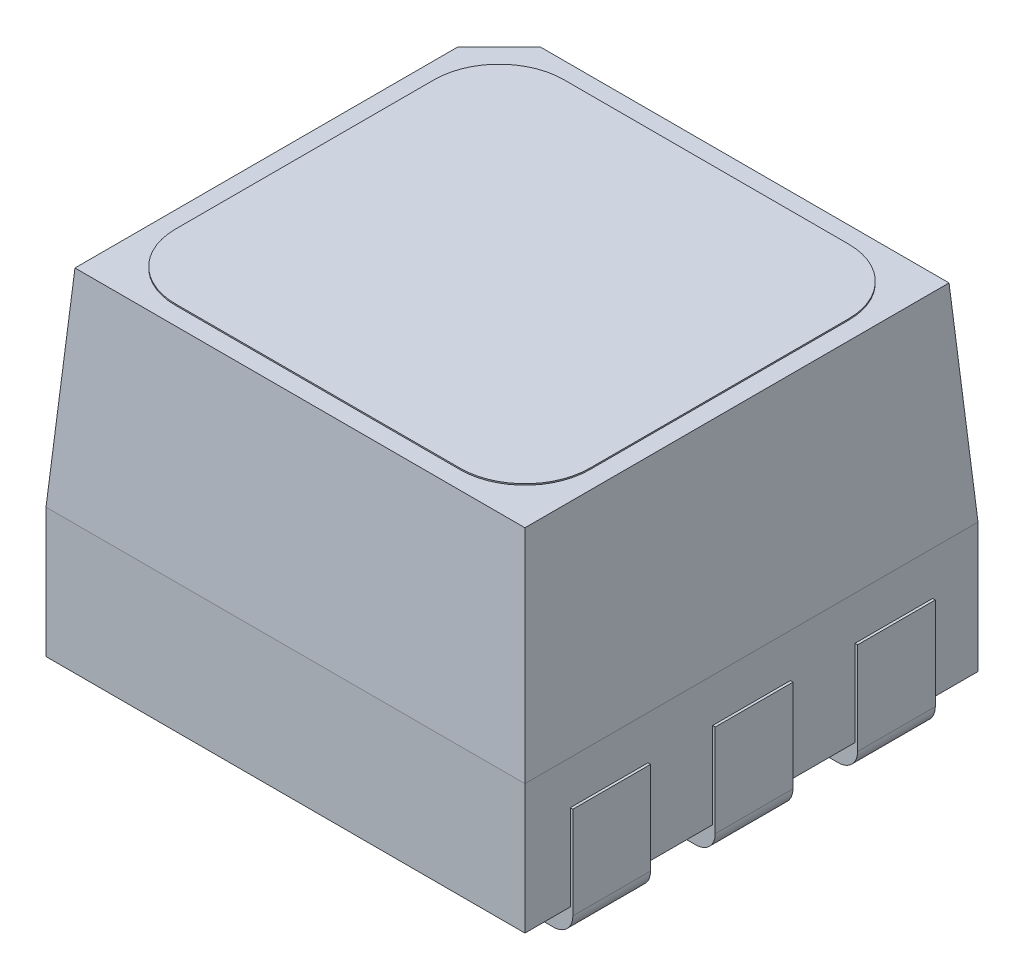
from build123d import *

# Parameters (mm, degrees)
ESQUISSE1_W                  = 3.7
ESQUISSE1_H                  = 3.5
BOSS_EXTRU_1_DEPTH           = 1
ESQUISSE2_W                  = 3.7
ESQUISSE2_H                  = 3.5
BOSS_EXTRU_2_DEPTH           = 1.6
BOSS_EXTRU_2_TAPER           = 4
BOSS_EXTRU_3_DEPTH           = 0.01
ENL_V_MAT_EXTRU_2_DEPTH      = 0.5
ESQUISSE5_W                  = 0.8
ESQUISSE5_H                  = 0.6
BOSS_EXTRU_4_DEPTH           = 0.2
ESQUISSE6_W                  = 0.6
ESQUISSE6_H                  = 0.864001059
ENL_V_MAT_EXTRU_3_DEPTH      = 0.2
ESQUISSE8_W                  = 0.6
ESQUISSE8_H                  = 0.800354125
ENL_V_MAT_EXTRU_4_DEPTH      = 0.2
ESQUISSE9_W                  = 0.6
ESQUISSE9_H                  = 0.864001059
BOSS_EXTRU_5_DEPTH           = 0.22
ESQUISSE10_W                 = 0.6
ESQUISSE10_H                 = 0.800354125
BOSS_EXTRU_6_DEPTH           = 0.22
ENL_V_MAT_EXTRU_5_DEPTH      = 5.497944045
CORPS_D_PLACER_COPIER1_ANGLE = 180


with BuildPart() as part:
    # Esquisse1 → Boss.-Extru.1 (new body)
    with BuildSketch(Plane(origin=(0, 0, 0), x_dir=(1, 0, 0), z_dir=(0, 1, 0))):
        Rectangle(ESQUISSE1_W, ESQUISSE1_H)
    extrude(amount=BOSS_EXTRU_1_DEPTH)

    # Esquisse5 → Boss.-Extru.4 (add)
    with BuildSketch(Plane.XZ):
        with Locations((-1.45, 0)):
            Rectangle(ESQUISSE5_W, ESQUISSE5_H)
        with Locations((1.45, 0)):
            Rectangle(ESQUISSE5_W, ESQUISSE5_H)
        with Locations((1.45, 1.1)):
            Rectangle(ESQUISSE5_W, ESQUISSE5_H)
        with Locations((-1.45, 1.1)):
            Rectangle(ESQUISSE5_W, ESQUISSE5_H)
        with Locations((1.45, -1.1)):
            Rectangle(ESQUISSE5_W, ESQUISSE5_H)
        with Locations((-1.45, -1.1)):
            Rectangle(ESQUISSE5_W, ESQUISSE5_H)
    extrude(amount=BOSS_EXTRU_4_DEPTH)

    # Esquisse6 → Enlèv. mat.-Extru.3 (cut)
    with BuildSketch(Plane.ZY.offset(1.85)):
        with Locations((-1.1, 0.23200053)):
            Rectangle(ESQUISSE6_W, ESQUISSE6_H)
        with Locations((0, 0.23200053)):
            Rectangle(ESQUISSE6_W, ESQUISSE6_H)
        with Locations((1.1, 0.23200053)):
            Rectangle(ESQUISSE6_W, ESQUISSE6_H)
    extrude(amount=-ENL_V_MAT_EXTRU_3_DEPTH, mode=Mode.SUBTRACT)

    # Esquisse8 → Enlèv. mat.-Extru.4 (cut)
    with BuildSketch(Plane(origin=(1.85, 0, 0), x_dir=(0, 0, -1), z_dir=(1, 0, 0))):
        with Locations((-1.1, 0.200177063)):
            Rectangle(ESQUISSE8_W, ESQUISSE8_H)
        with Locations((0, 0.200177063)):
            Rectangle(ESQUISSE8_W, ESQUISSE8_H)
        with Locations((1.1, 0.200177063)):
            Rectangle(ESQUISSE8_W, ESQUISSE8_H)
    extrude(amount=-ENL_V_MAT_EXTRU_4_DEPTH, mode=Mode.SUBTRACT)

    # Esquisse9 → Boss.-Extru.5 (add)
    with BuildSketch(Plane.ZY.offset(1.65)):
        with Locations((-1.1, 0.23200053)):
            Rectangle(ESQUISSE9_W, ESQUISSE9_H)
        with Locations((0, 0.23200053)):
            Rectangle(ESQUISSE9_W, ESQUISSE9_H)
        with Locations((1.1, 0.23200053)):
            Rectangle(ESQUISSE9_W, ESQUISSE9_H)
    extrude(amount=BOSS_EXTRU_5_DEPTH)

    # Esquisse10 → Boss.-Extru.6 (add)
    with BuildSketch(Plane(origin=(1.65, 0, 0), x_dir=(0, 0, -1), z_dir=(1, 0, 0))):
        with Locations((-1.1, 0.200177063)):
            Rectangle(ESQUISSE10_W, ESQUISSE10_H)
        with Locations((0, 0.200177063)):
            Rectangle(ESQUISSE10_W, ESQUISSE10_H)
        with Locations((1.1, 0.200177063)):
            Rectangle(ESQUISSE10_W, ESQUISSE10_H)
    extrude(amount=BOSS_EXTRU_6_DEPTH)

    # Esquisse12 → Enlèv. mat.-Extru.5 (cut, through all)
    with BuildSketch(Plane.XY.offset(1.4)):
        with BuildLine():
            Line((-1.72, -0.2), (-2.05135205, -0.2))
            Line((-2.05135205, -0.2), (-2.05135205, 0))
            Line((-2.05135205, 0), (-1.87, 0))
            Line((-1.87, 0), (-1.87, -0.05))
            ThreePointArc((-1.87, -0.05), (-1.826066017, -0.156066017), (-1.72, -0.2))
        make_face()
        with BuildLine():
            Line((1.72, -0.2), (2.046281508, -0.2))
            Line((2.046281508, -0.2), (2.046281508, 0))
            Line((2.046281508, 0), (1.87, 0))
            Line((1.87, 0), (1.87, -0.05))
            ThreePointArc((1.87, -0.05), (1.826066017, -0.156066017), (1.72, -0.2))
        make_face()
    extrude(amount=-ENL_V_MAT_EXTRU_5_DEPTH, mode=Mode.SUBTRACT)


with BuildPart() as body_2:
    # Esquisse2 → Boss.-Extru.2 (new body)
    with BuildSketch(Plane(origin=(0, 1, 0), x_dir=(1, 0, 0), z_dir=(0, 1, 0))):
        Rectangle(ESQUISSE2_W, ESQUISSE2_H)
    extrude(amount=BOSS_EXTRU_2_DEPTH, taper=BOSS_EXTRU_2_TAPER)

    # Esquisse3 → Boss.-Extru.3 (add)
    with BuildSketch(Plane(origin=(0, 2.6, 0), x_dir=(1, 0, 0), z_dir=(0, 1, 0))):
        with BuildLine():
            Line((-1.1, -1.5), (1.1, -1.5))
            ThreePointArc((1.1, -1.5), (1.453553391, -1.353553391), (1.6, -1))
            Line((1.6, -1), (1.6, 1))
            ThreePointArc((1.6, 1), (1.453553391, 1.353553391), (1.1, 1.5))
            Line((1.1, 1.5), (-1.1, 1.5))
            ThreePointArc((-1.1, 1.5), (-1.453553391, 1.353553391), (-1.6, 1))
            Line((-1.6, 1), (-1.6, -1))
            ThreePointArc((-1.6, -1), (-1.453553391, -1.353553391), (-1.1, -1.5))
        make_face()
    extrude(amount=BOSS_EXTRU_3_DEPTH)

    # Esquisse4 → Enlèv. mat.-Extru.2 (cut)
    with BuildSketch(Plane(origin=(0, 2.6, 0), x_dir=(1, 0, 0), z_dir=(0, 1, 0))):
        Polygon((1.90586632, -1.76321677), (1.90586632, -1.151569279), (1.295152698, -1.76321677), align=None)
    extrude(amount=-ENL_V_MAT_EXTRU_2_DEPTH, mode=Mode.SUBTRACT)


with BuildPart() as body_2_1:
    # Corps-Déplacer/Copier1: moved
    add(body_2.part.rotate(Axis((0, 0, 0), (0, 1, 0)), CORPS_D_PLACER_COPIER1_ANGLE))


with BuildPart() as part_1:
    # Corps-Déplacer/Copier1: moved
    add(part.part.rotate(Axis((0, 0, 0), (0, 1, 0)), CORPS_D_PLACER_COPIER1_ANGLE))


solid = Compound([body_2_1.part, part_1.part])
